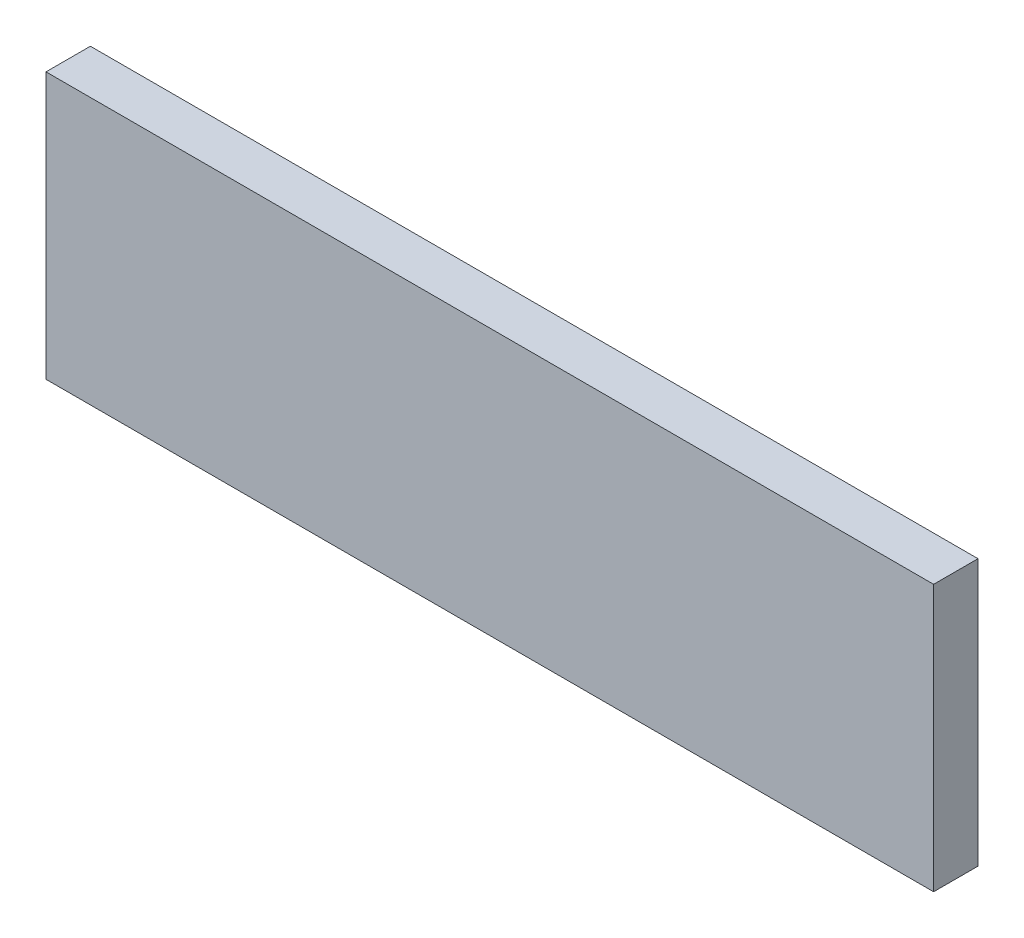
from build123d import *

# Parameters (mm, degrees)
SKETCH1_W           = 100
SKETCH1_H           = 5
BOSS_EXTRUDE1_DEPTH = 30


with BuildPart() as part:
    # Sketch1 → Boss-Extrude1 (new body)
    with BuildSketch(Plane(origin=(0, 0, 0), x_dir=(1, 0, 0), z_dir=(0, 1, 0))):
        with Locations((-9.956778207, 2.953896951)):
            Rectangle(SKETCH1_W, SKETCH1_H)
    extrude(amount=BOSS_EXTRUDE1_DEPTH)


solid = part.part
